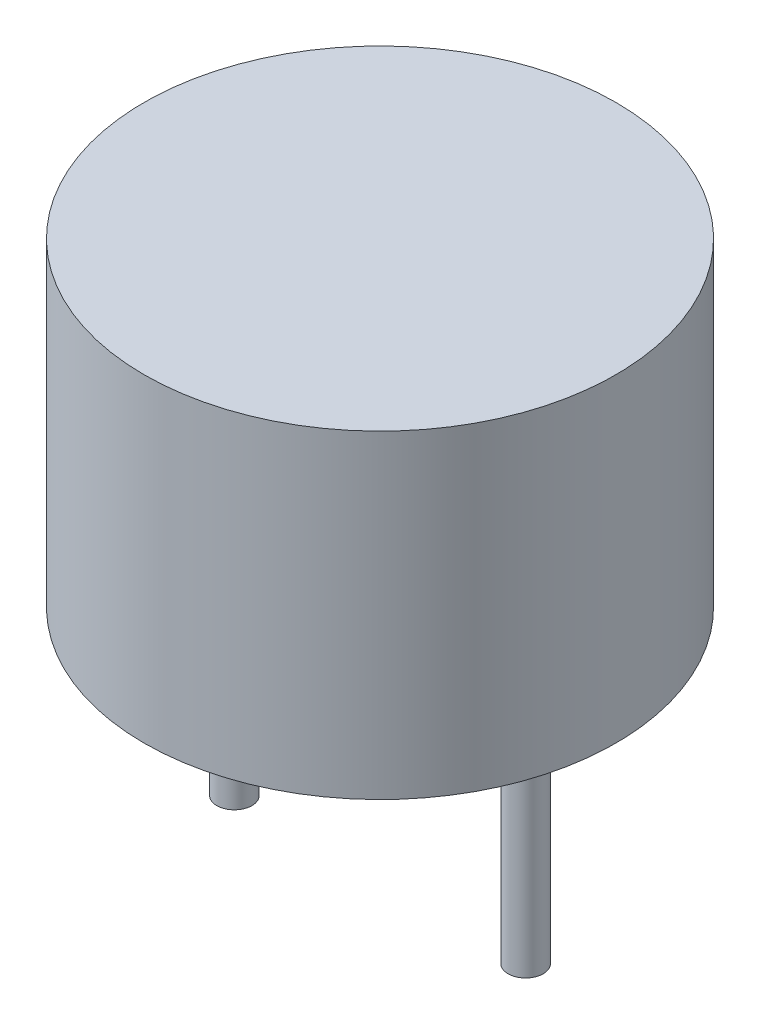
from build123d import *

# Parameters (mm, degrees)
SKETCH1_R           = 6.57225
BOSS_EXTRUDE1_DEPTH = 8.89
SKETCH2_R           = 0.48895
BOSS_EXTRUDE2_DEPTH = 6.5786


with BuildPart() as part:
    # Sketch1 → Boss-Extrude1 (new body)
    with BuildSketch(Plane(origin=(0, 0, 0), x_dir=(1, 0, 0), z_dir=(0, 1, 0))):
        with Locations(Location((0, 0, 0), (0, 0, 270))):
            Circle(SKETCH1_R)
    extrude(amount=BOSS_EXTRUDE1_DEPTH)

    # Sketch2 → Boss-Extrude2 (add)
    with BuildSketch(Plane.XZ):
        with Locations(Location((-4.05765, 0, 0), (0, 0, 90))):
            Circle(SKETCH2_R)
        with Locations(Location((4.05765, 0, 0), (0, 0, 90))):
            Circle(SKETCH2_R)
    extrude(amount=BOSS_EXTRUDE2_DEPTH)


solid = part.part
